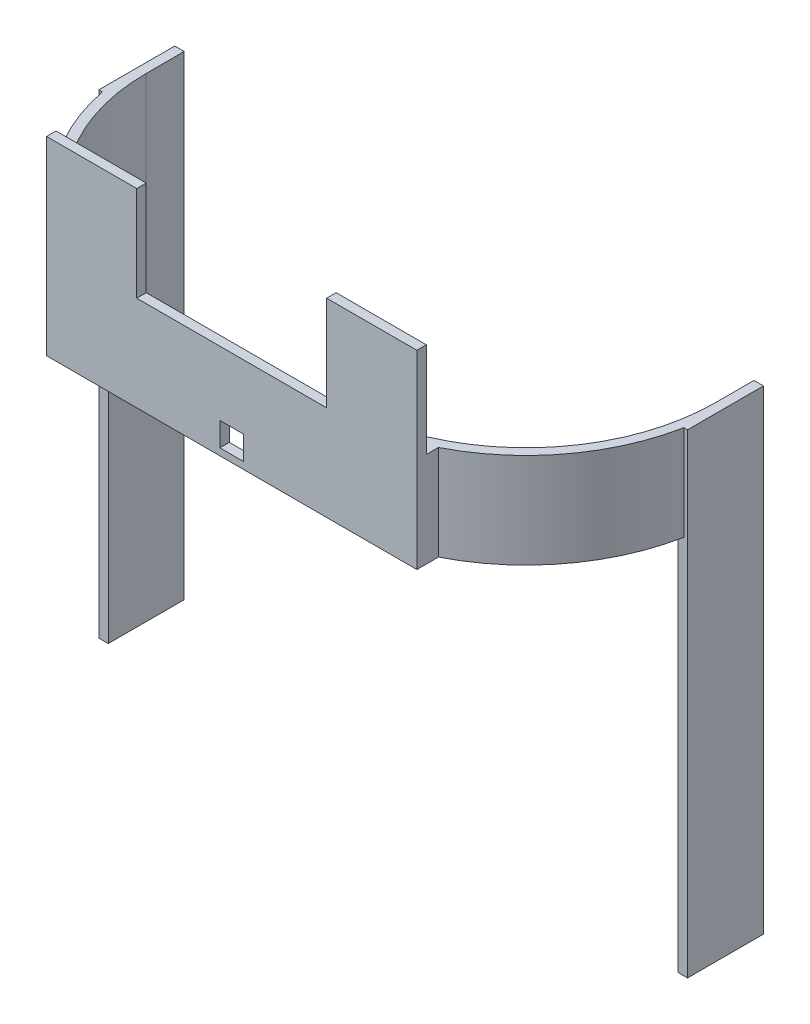
from build123d import *

# Parameters (mm, degrees)
EXTRUDE_1_DEPTH          = 40
SKETCH_3_W               = 4
SKETCH_3_H               = 32
EXTRUDE_2_DEPTH          = 160
EXTRUDE_3_DEPTH          = 40
SKETCH_6_W               = 38
SKETCH_6_H               = 4
EXTRUDE_4_DEPTH          = 40
CUT_EXTRUDE_1_DEPTH      = 226.778652667
CUT_EXTRUDE_1_DEPTH_BACK = 226.778652667
SKETCH_4_W               = 10
SKETCH_4_H               = 10


with BuildPart() as part:
    # 草图2 → 凸台-拉伸1 (new body)
    with BuildSketch(Plane(origin=(0, 0, 0), x_dir=(1, 0, 0), z_dir=(0, 1, 0))):
        with BuildLine():
            Line((-40, -80), (40, -80))
            ThreePointArc((40, -80), (96.568542495, -56.568542495), (120, 0))
            Line((120, 0), (120, 16))
            Line((120, 16), (124, 16))
            Line((124, 16), (124, -16))
            Line((124, -16), (122.462112512, -16))
            ThreePointArc((122.462112512, -16), (93.441556864, -64.807406984), (40, -84))
            Line((40, -84), (-40, -84))
            ThreePointArc((-40, -84), (-93.441556864, -64.807406984), (-122.462112512, -16))
            Line((-122.462112512, -16), (-124, -16))
            Line((-124, -16), (-124, 16))
            Line((-124, 16), (-120, 16))
            Line((-120, 16), (-120, 0))
            ThreePointArc((-120, 0), (-96.568542495, -56.568542495), (-40, -80))
        make_face()
    extrude(amount=EXTRUDE_1_DEPTH)

    # 草图3 → 凸台-拉伸2 (add)
    with BuildSketch(Plane.XZ):
        with Locations((-122, 0)):
            Rectangle(SKETCH_3_W, SKETCH_3_H)
        with Locations((122, 0)):
            Rectangle(SKETCH_3_W, SKETCH_3_H)
    extrude(amount=EXTRUDE_2_DEPTH)

    # 草图5 → 凸台-拉伸3 (add)
    with BuildSketch(Plane(origin=(0, 40, 0), x_dir=(1, 0, 0), z_dir=(0, 1, 0))):
        Polygon((-40, -84), (-78, -84), (-78, -74.913283201), (-55.5334574, -80.946187921), (52.897278528, -80.946187921), (78, -72.607731722), (78, -84), (40, -84), align=None)
    extrude(amount=-EXTRUDE_3_DEPTH)

    # 草图6 → 凸台-拉伸4 (add)
    with BuildSketch(Plane(origin=(0, 40, 0), x_dir=(1, 0, 0), z_dir=(0, 1, 0))):
        with Locations((-59, -82)):
            Rectangle(SKETCH_6_W, SKETCH_6_H)
        with Locations((59, -82)):
            Rectangle(SKETCH_6_W, SKETCH_6_H)
    extrude(amount=EXTRUDE_4_DEPTH)

    # 草图4 → 切除-拉伸1 (cut, two sides: drawn at the far end of the back side and taken through both)
    with BuildSketch(Plane.XY.offset(84).offset(-CUT_EXTRUDE_1_DEPTH_BACK)):
        with Locations((0, 7.906009126)):
            Rectangle(SKETCH_4_W, SKETCH_4_H)
    extrude(amount=CUT_EXTRUDE_1_DEPTH + CUT_EXTRUDE_1_DEPTH_BACK, mode=Mode.SUBTRACT)


solid = part.part
